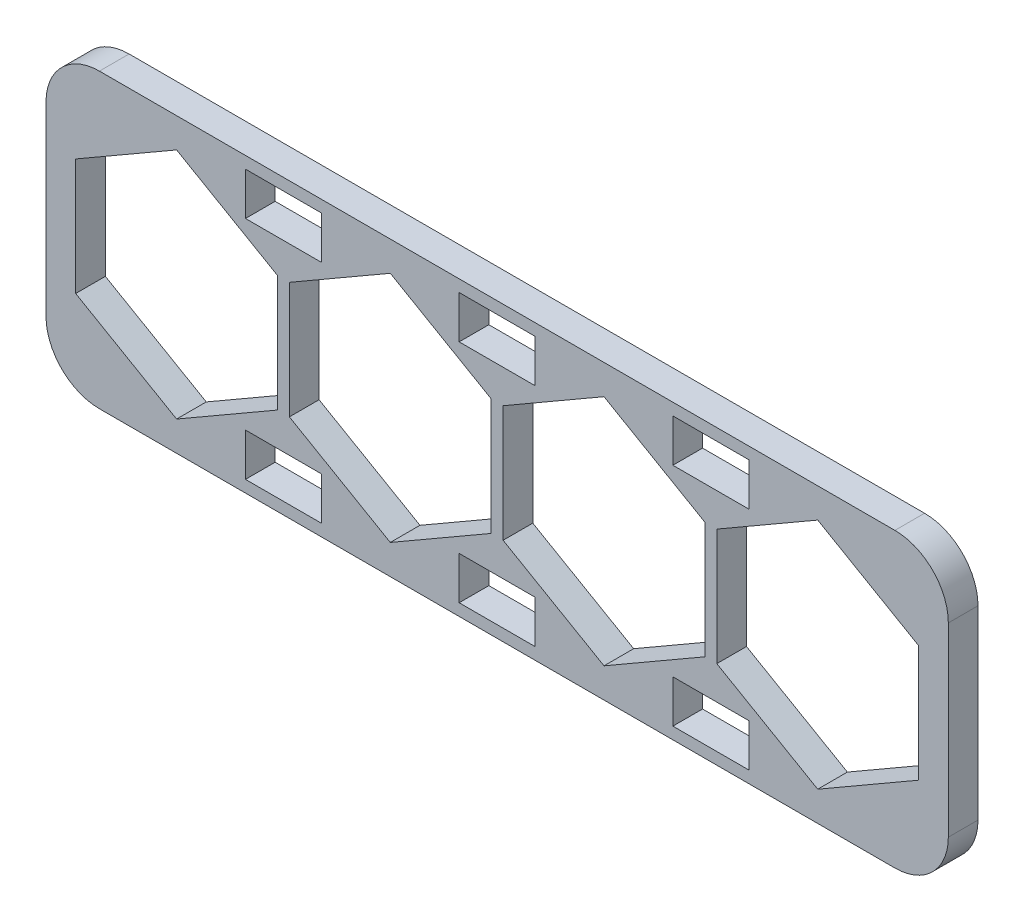
from build123d import *

# Parameters (mm, degrees)
SKETCH1_W           = 8.128
SKETCH1_H           = 4.572
BOSS_EXTRUDE1_DEPTH = 3.175


with BuildPart() as part:
    # Sketch1 → Boss-Extrude1 (new body)
    with BuildSketch(Plane.XY):
        with BuildLine():
            Line((-8.255, 15.639992312), (76.835, 15.639992312))
            ThreePointArc((76.835, 15.639992312), (80.876115254, 13.966107566), (82.55, 9.924992312))
            Line((82.55, 9.924992312), (82.55, -9.924992312))
            ThreePointArc((82.55, -9.924992312), (80.876115254, -13.966107566), (76.835, -15.639992312))
            Line((76.835, -15.639992312), (-8.255, -15.639992312))
            ThreePointArc((-8.255, -15.639992312), (-12.296115254, -13.966107566), (-13.97, -9.924992312))
            Line((-13.97, -9.924992312), (-13.97, 9.924992312))
            ThreePointArc((-13.97, 9.924992312), (-12.296115254, 13.966107566), (-8.255, 15.639992312))
        make_face()
        Polygon((12.065, -6.232496156), (22.86, -12.464992312), (33.655, -6.232496156), (33.655, 6.232496156), (22.86, 12.464992312), (12.065, 6.232496156), align=None, mode=Mode.SUBTRACT)
        Polygon((34.925, -6.232496156), (45.72, -12.464992312), (56.515, -6.232496156), (56.515, 6.232496156), (45.72, 12.464992312), (34.925, 6.232496156), align=None, mode=Mode.SUBTRACT)
        Polygon((-10.795, -6.232496156), (0, -12.464992312), (10.795, -6.232496156), (10.795, 6.232496156), (0, 12.464992312), (-10.795, 6.232496156), align=None, mode=Mode.SUBTRACT)
        Polygon((57.785, -6.232496156), (68.58, -12.464992312), (79.375, -6.232496156), (79.375, 6.232496156), (68.58, 12.464992312), (57.785, 6.232496156), align=None, mode=Mode.SUBTRACT)
        with Locations((34.29, 12.083992312)):
            Rectangle(SKETCH1_W, SKETCH1_H, mode=Mode.SUBTRACT)
        with Locations((11.43, 12.083992312)):
            Rectangle(SKETCH1_W, SKETCH1_H, mode=Mode.SUBTRACT)
        with Locations((57.15, 12.083992312)):
            Rectangle(SKETCH1_W, SKETCH1_H, mode=Mode.SUBTRACT)
        with Locations((57.15, -12.083992312)):
            Rectangle(SKETCH1_W, SKETCH1_H, mode=Mode.SUBTRACT)
        with Locations((34.29, -12.083992312)):
            Rectangle(SKETCH1_W, SKETCH1_H, mode=Mode.SUBTRACT)
        with Locations((11.43, -12.083992312)):
            Rectangle(SKETCH1_W, SKETCH1_H, mode=Mode.SUBTRACT)
    extrude(amount=BOSS_EXTRUDE1_DEPTH)


solid = part.part
